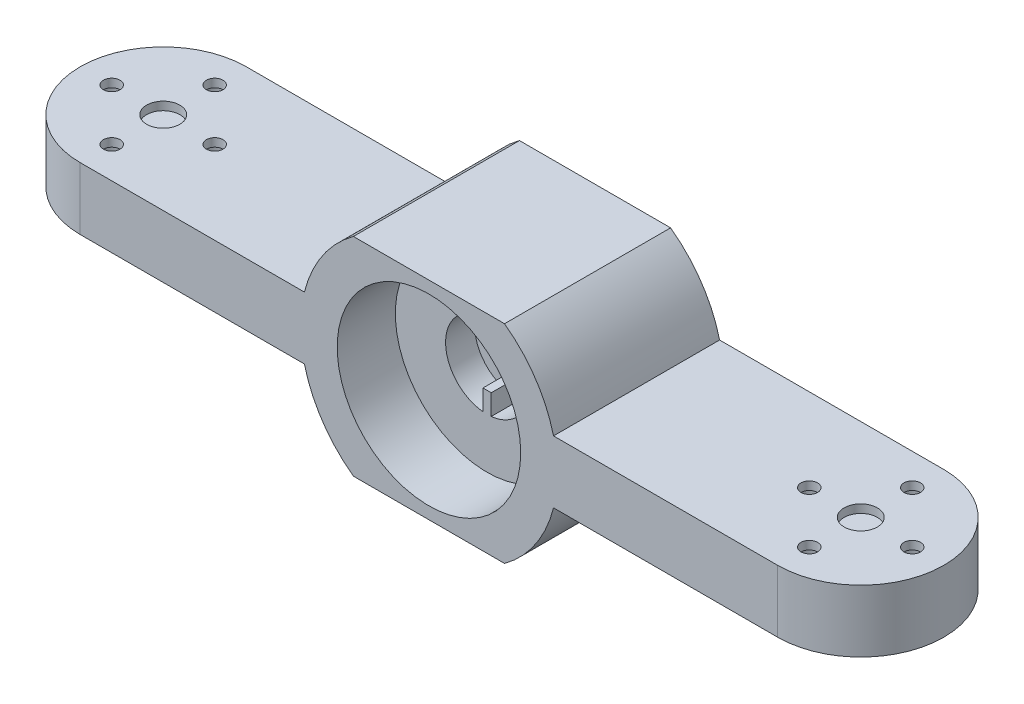
from build123d import *

# Parameters (mm, degrees)
BOSS_EXTRUDE1_DEPTH = 25
SKETCH2_R           = 11.05
CUT_EXTRUDE1_DEPTH  = 7
CUT_EXTRUDE3_DEPTH  = 8.75
CUT_EXTRUDE5_DEPTH  = 8.75
SKETCH5_R           = 1
CUT_EXTRUDE6_DEPTH  = 7.5
SKETCH6_R           = 1.95
CUT_EXTRUDE7_DEPTH  = 6.5
SKETCH7_R           = 2
CUT_EXTRUDE8_DEPTH  = 1
CUT_EXTRUDE9_DEPTH  = 62.065538563
CUT_EXTRUDE10_DEPTH = 3.5


with BuildPart() as part:
    # Sketch1 → Boss-Extrude1 (new body)
    with BuildSketch(Plane(origin=(0, 0, 0), x_dir=(1, 0, 0), z_dir=(0, 1, 0))):
        with BuildLine():
            Line((-42, -10), (42, -10))
            ThreePointArc((42, -10), (52, 0), (42, 10))
            Line((42, 10), (-42, 10))
            ThreePointArc((-42, 10), (-52, 0), (-42, -10))
        make_face()
    extrude(amount=BOSS_EXTRUDE1_DEPTH)

    # Sketch2 → Cut-Extrude1 (cut)
    with BuildSketch(Plane.XY.offset(10)):
        with Locations((0, 12.5)):
            Circle(SKETCH2_R)
    extrude(amount=-CUT_EXTRUDE1_DEPTH, mode=Mode.SUBTRACT)

    # Sketch3 → Cut-Extrude3 (cut)
    with BuildSketch(Plane.XZ):
        with BuildLine():
            Line((15, -10), (15, 10))
            Line((15, 10), (42, 10))
            ThreePointArc((42, 10), (52, 0), (42, -10))
            Line((42, -10), (15, -10))
        make_face()
        with BuildLine():
            Line((-15, -10), (-15, 10))
            Line((-15, 10), (-42, 10))
            ThreePointArc((-42, 10), (-52, 0), (-42, -10))
            Line((-42, -10), (-15, -10))
        make_face()
    extrude(amount=-CUT_EXTRUDE3_DEPTH, mode=Mode.SUBTRACT)

    # Sketch4 → Cut-Extrude5 (cut)
    with BuildSketch(Plane(origin=(0, 25, 0), x_dir=(1, 0, 0), z_dir=(0, 1, 0))):
        with BuildLine():
            Line((15, -10), (15, 10))
            Line((15, 10), (55, 10))
            ThreePointArc((55, 10), (65, 0), (55, -10))
            Line((55, -10), (15, -10))
        make_face()
        with BuildLine():
            Line((-15, -10), (-15, 10))
            Line((-15, 10), (-55, 10))
            ThreePointArc((-55, 10), (-65, 0), (-55, -10))
            Line((-55, -10), (-15, -10))
        make_face()
    extrude(amount=-CUT_EXTRUDE5_DEPTH, mode=Mode.SUBTRACT)

    # Sketch5 → Cut-Extrude6 (cut)
    with BuildSketch(Plane(origin=(0, 16.25, 0), x_dir=(1, 0, 0), z_dir=(0, 1, 0))):
        with Locations(Location((-42, 6.2, 0), (0, 0, 270))):
            Circle(SKETCH5_R)
        with Locations(Location((-35.8, 0, 0), (0, 0, 270))):
            Circle(SKETCH5_R)
        with Locations(Location((-42, -6.2, 0), (0, 0, 270))):
            Circle(SKETCH5_R)
        with Locations(Location((-48.2, 0, 0), (0, 0, 270))):
            Circle(SKETCH5_R)
        with Locations(Location((42, 6.2, 0), (0, 0, 270))):
            Circle(SKETCH5_R)
        with Locations(Location((48.2, 0, 0), (0, 0, 270))):
            Circle(SKETCH5_R)
        with Locations(Location((42, -6.2, 0), (0, 0, 270))):
            Circle(SKETCH5_R)
        with Locations(Location((35.8, 0, 0), (0, 0, 270))):
            Circle(SKETCH5_R)
    extrude(amount=-CUT_EXTRUDE6_DEPTH, mode=Mode.SUBTRACT)

    # Sketch6 → Cut-Extrude7 (cut)
    with BuildSketch(Plane.XZ.offset(-8.75)):
        with Locations(Location((-42, 6.2, 0), (0, 0, 270))):
            Circle(SKETCH6_R)
        with Locations(Location((-35.8, 0, 0), (0, 0, 270))):
            Circle(SKETCH6_R)
        with Locations(Location((-48.2, 0, 0), (0, 0, 270))):
            Circle(SKETCH6_R)
        with Locations(Location((-42, -6.2, 0), (0, 0, 270))):
            Circle(SKETCH6_R)
        with Locations(Location((42, 6.2, 0), (0, 0, 270))):
            Circle(SKETCH6_R)
        with Locations(Location((48.2, 0, 0), (0, 0, 270))):
            Circle(SKETCH6_R)
        with Locations(Location((35.8, 0, 0), (0, 0, 270))):
            Circle(SKETCH6_R)
        with Locations(Location((42, -6.2, 0), (0, 0, 270))):
            Circle(SKETCH6_R)
    extrude(amount=-CUT_EXTRUDE7_DEPTH, mode=Mode.SUBTRACT)

    # Sketch7 → Cut-Extrude8 (cut)
    with BuildSketch(Plane(origin=(0, 16.25, 0), x_dir=(1, 0, 0), z_dir=(0, 1, 0))):
        with Locations(Location((-42, 0, 0), (0, 0, 270))):
            Circle(SKETCH7_R)
        with Locations(Location((42, 0, 0), (0, 0, 270))):
            Circle(SKETCH7_R)
    extrude(amount=-CUT_EXTRUDE8_DEPTH, mode=Mode.SUBTRACT)

    # Sketch8 → Cut-Extrude9 (cut, through all)
    with BuildSketch(Plane.XY.offset(10)):
        with BuildLine():
            Line((-15, 16.25), (-15, 25))
            Line((-15, 25), (-9.100137362, 25))
            ThreePointArc((-9.100137362, 25), (-12.819702813, 21.143941218), (-15, 16.25))
        make_face()
        with BuildLine():
            Line((15, 0), (9.100137362, 0))
            ThreePointArc((9.100137362, 0), (12.819702813, 3.856058782), (15, 8.75))
            Line((15, 8.75), (15, 0))
        make_face()
        with BuildLine():
            Line((15, 25), (9.100137362, 25))
            ThreePointArc((9.100137362, 25), (12.819702813, 21.143941218), (15, 16.25))
            Line((15, 16.25), (15, 25))
        make_face()
        with BuildLine():
            Line((-15, 0), (-15, 8.75))
            ThreePointArc((-15, 8.75), (-12.819702813, 3.856058782), (-9.100137362, 0))
            Line((-9.100137362, 0), (-15, 0))
        make_face()
    extrude(amount=-CUT_EXTRUDE9_DEPTH, mode=Mode.SUBTRACT)

    # Sketch9 → Cut-Extrude10 (cut)
    with BuildSketch(Plane.XY.offset(3)):
        with BuildLine():
            Line((0.5, 10), (0.5, 7.525062814))
            ThreePointArc((0.5, 7.525062814), (5, 12.5), (0.5, 17.474937186))
            Line((0.5, 17.474937186), (0.5, 15))
            Line((0.5, 15), (-0.5, 15))
            Line((-0.5, 15), (-0.5, 17.474937186))
            ThreePointArc((-0.5, 17.474937186), (-5, 12.5), (-0.5, 7.525062814))
            Line((-0.5, 7.525062814), (-0.5, 10))
            Line((-0.5, 10), (0.5, 10))
        make_face()
    extrude(amount=-CUT_EXTRUDE10_DEPTH, mode=Mode.SUBTRACT)


solid = part.part
